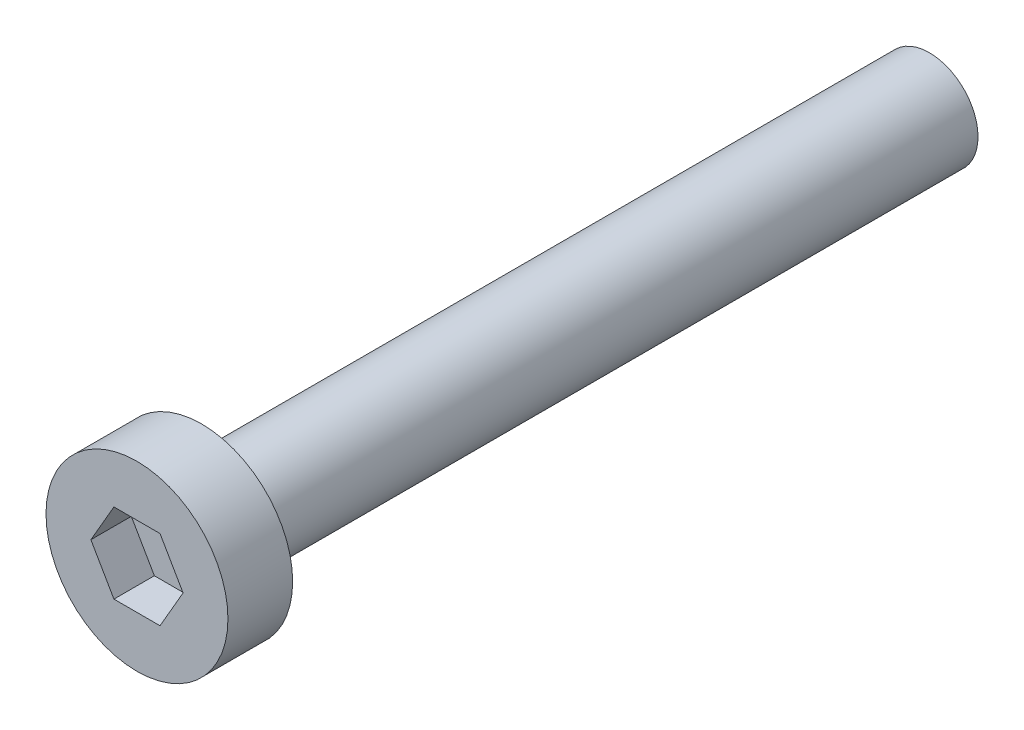
from build123d import *

# Parameters (mm, degrees)
ESBO_O1_R                = 5.625
RESSALTO_EXTRUS_O1_DEPTH = 4
CORTE_EXTRUS_O1_DEPTH    = 2.5
ESBO_O3_R                = 3
RESSALTO_EXTRUS_O2_DEPTH = 45


with BuildPart() as part:
    # Esboço1 → Ressalto-extrusão1 (new body)
    with BuildSketch(Plane.XY):
        Circle(ESBO_O1_R)
    extrude(amount=RESSALTO_EXTRUS_O1_DEPTH)

    # Esboço2 → Corte-extrusão1 (cut)
    with BuildSketch(Plane.XY.offset(4)):
        Polygon((2.85, 0), (1.425, 2.468172401), (-1.425, 2.468172401), (-2.85, 0), (-1.425, -2.468172401), (1.425, -2.468172401), align=None)
    extrude(amount=-CORTE_EXTRUS_O1_DEPTH, mode=Mode.SUBTRACT)

    # Esboço3 → Ressalto-extrusão2 (add)
    with BuildSketch(Plane(origin=(0, 0, 0), x_dir=(-1, 0, 0), z_dir=(0, 0, -1))):
        with Locations(Location((0, 0, 0), (0, 0, 180))):
            Circle(ESBO_O3_R)
    extrude(amount=RESSALTO_EXTRUS_O2_DEPTH)


solid = part.part
